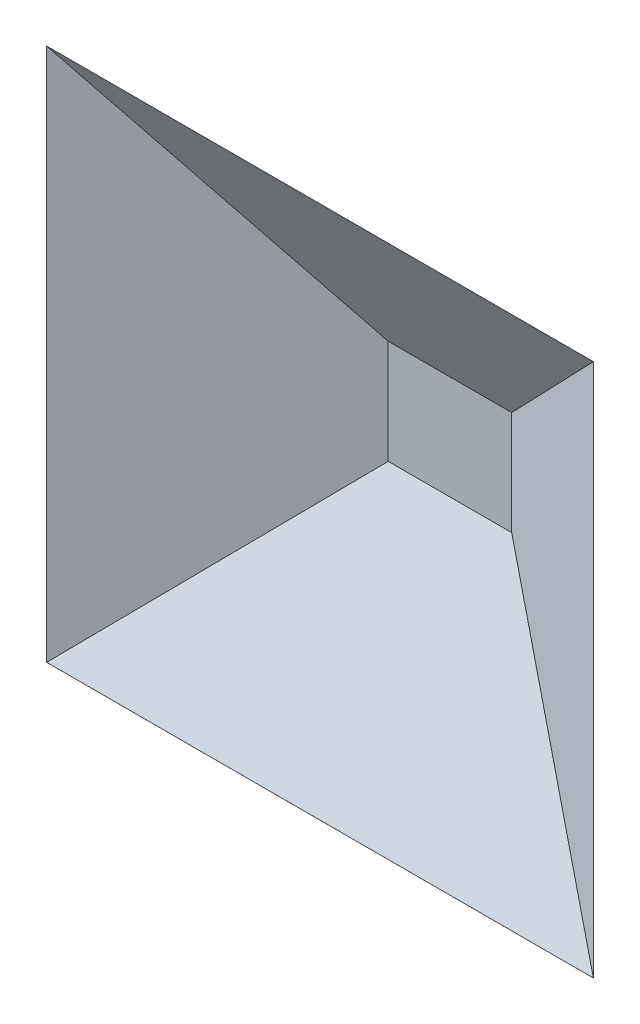
from build123d import *

# Parameters (mm, degrees)
SHELL_1_T = -0.01


with BuildPart() as part:
    # 草图3 → 放样1 section 0
    with BuildSketch(Plane.XY):
        with BuildLine():
            Line((-47.5, 40), (47.5, 40))
            Line((47.5, 40), (47.5, -40))
            Line((47.5, -40), (-47.5, -40))
            Line((-47.5, -40), (-47.5, 40))
        make_face()
    # 草图4 → 放样1 section 1
    with BuildSketch(Plane.XY.offset(100)):
        with BuildLine():
            Line((-210.3, 205.3), (210.3, 205.3))
            Line((210.3, 205.3), (210.3, -205.3))
            Line((210.3, -205.3), (-210.3, -205.3))
            Line((-210.3, -205.3), (-210.3, 205.3))
        make_face()
    loft()

    # 抽壳1
    shell_1_openings = [part.faces().sort_by_distance(p)[0] for p in [
        (0, 0, 100),
    ]]
    offset(amount=SHELL_1_T, openings=shell_1_openings)


solid = part.part
